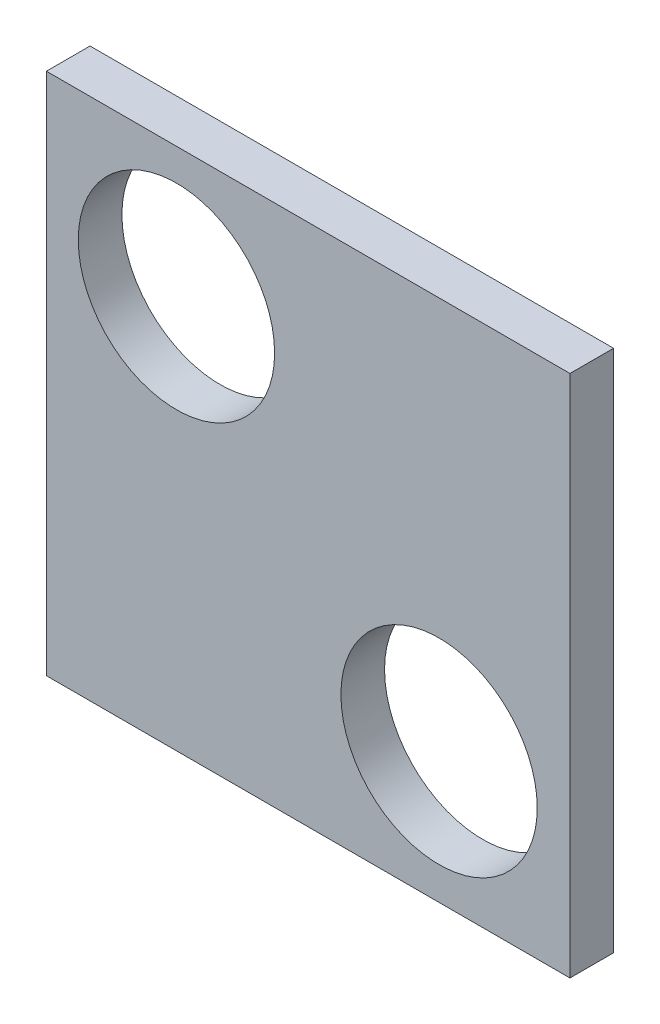
from build123d import *

# Parameters (mm, degrees)
SKETCH2_W           = 3
SKETCH2_H           = 3
SKETCH2_R           = 0.5625
BOSS_EXTRUDE1_DEPTH = 0.25
SKETCH5_R           = 0.5625
CUT_EXTRUDE1_DEPTH  = 5.25


with BuildPart() as part:
    # Sketch2 → Boss-Extrude1 (new body)
    with BuildSketch(Plane.XY):
        with Locations((1.5, 1.5)):
            Rectangle(SKETCH2_W, SKETCH2_H)
        with Locations((0.745068251, 2.254931749)):
            Circle(SKETCH2_R, mode=Mode.SUBTRACT)
    extrude(amount=BOSS_EXTRUDE1_DEPTH)

    # Sketch5 → Cut-Extrude1 (cut, through all)
    with BuildSketch(Plane.XY.offset(0.25)):
        with Locations((2.25, 0.75)):
            Circle(SKETCH5_R)
    extrude(amount=-CUT_EXTRUDE1_DEPTH, mode=Mode.SUBTRACT)


solid = part.part
